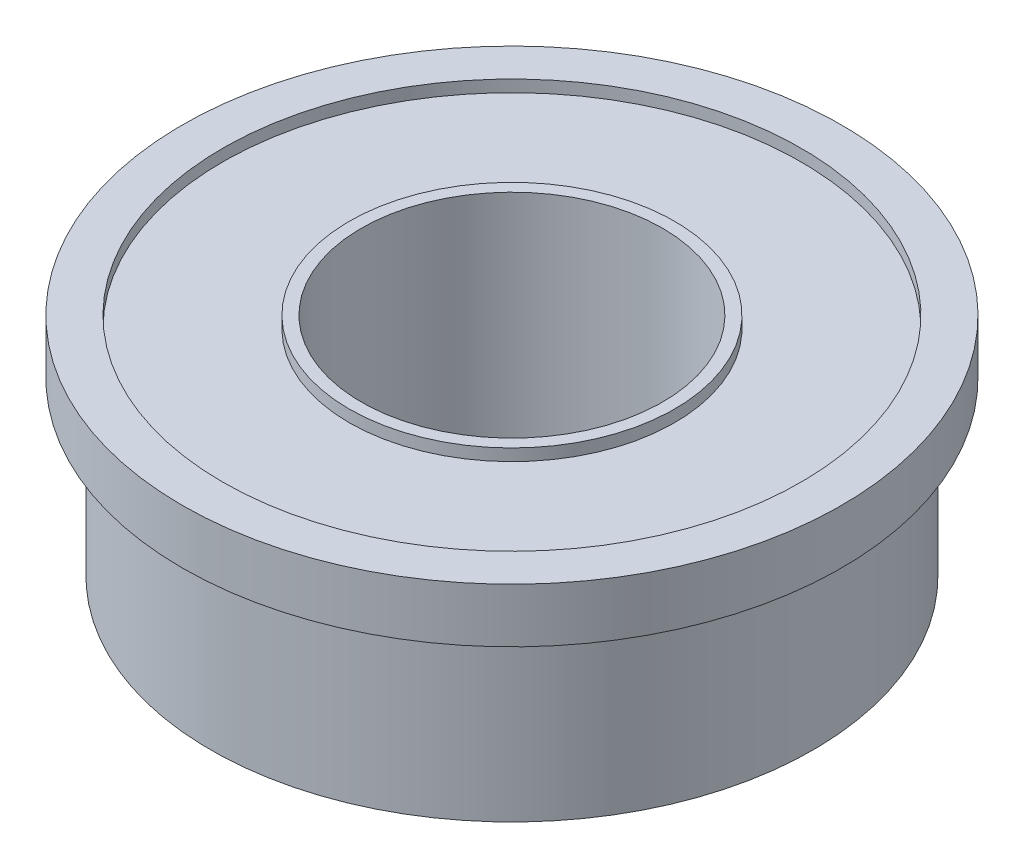
from build123d import *

# Parameters (mm, degrees)
SKETCH1_R           = 6.35
SKETCH1_R_2         = 3.175
BOSS_EXTRUDE1_DEPTH = 4.7625
SKETCH2_R           = 6.096
SKETCH2_R_2         = 3.429
CUT_EXTRUDE1_DEPTH  = 0.25
BOSS_EXTRUDE2_START = -1.143
SKETCH3_R           = 6.9469
SKETCH3_R_2         = 6.35
BOSS_EXTRUDE2_DEPTH = 1.143


with BuildPart() as part:
    # Sketch1 → Boss-Extrude1 (new body)
    with BuildSketch(Plane(origin=(0, 0, 0), x_dir=(1, 0, 0), z_dir=(0, 1, 0))):
        with Locations(Location((0, 0, 0), (0, 0, 90))):
            Circle(SKETCH1_R)
        with Locations(Location((0, 0, 0), (0, 0, 90))):
            Circle(SKETCH1_R_2, mode=Mode.SUBTRACT)
    extrude(amount=BOSS_EXTRUDE1_DEPTH)

    # Sketch2 → Cut-Extrude1 (cut)
    with BuildSketch(Plane(origin=(0, 4.7625, 0), x_dir=(1, 0, 0), z_dir=(0, 1, 0))):
        with Locations(Location((0, 0, 0), (0, 0, 270))):
            Circle(SKETCH2_R)
        with Locations(Location((0, 0, 0), (0, 0, 270))):
            Circle(SKETCH2_R_2, mode=Mode.SUBTRACT)
    cut_extrude1 = extrude(amount=-CUT_EXTRUDE1_DEPTH, mode=Mode.SUBTRACT)

    # Mirror1: Cut-Extrude1 across plane
    add(cut_extrude1.mirror(Plane.ZX.offset(2.38125)), mode=Mode.SUBTRACT)

    # Sketch3 → Boss-Extrude2 (add)
    with BuildSketch(Plane(origin=(0, 4.7625, 0), x_dir=(1, 0, 0), z_dir=(0, 1, 0)).offset(BOSS_EXTRUDE2_START)):
        with Locations(Location((0, 0, 0), (0, 0, 270))):
            Circle(SKETCH3_R)
        with Locations(Location((0, 0, 0), (0, 0, 90))):
            Circle(SKETCH3_R_2, mode=Mode.SUBTRACT)
    extrude(amount=BOSS_EXTRUDE2_DEPTH)


solid = part.part
